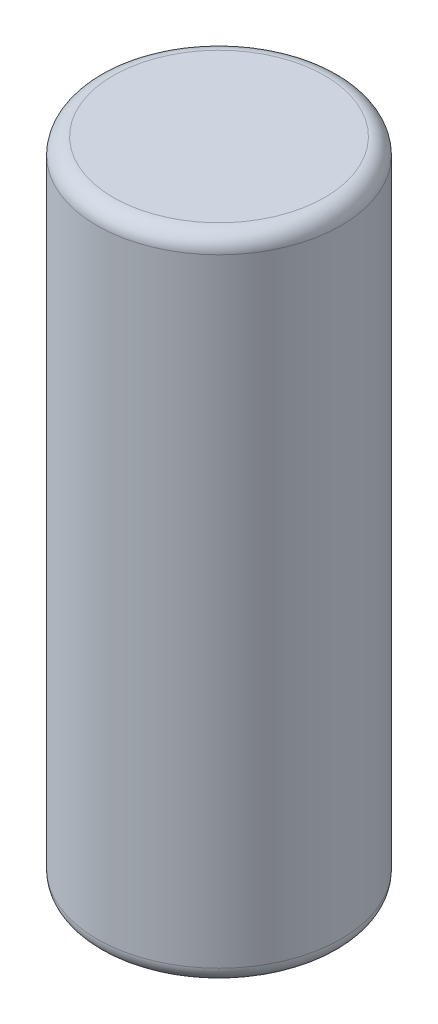
from build123d import *

# Parameters (mm, degrees)
SKETCH1_R           = 75
BOSS_EXTRUDE1_DEPTH = 400
FILLET1_R           = 10
FILLET2_R           = 10


with BuildPart() as part:
    # Sketch1 → Boss-Extrude1 (new body)
    with BuildSketch(Plane(origin=(0, 0, 0), x_dir=(1, 0, 0), z_dir=(0, 1, 0))):
        with Locations(Location((0, 0, 0), (0, 0, 90))):
            Circle(SKETCH1_R)
    extrude(amount=BOSS_EXTRUDE1_DEPTH)

    # Fillet1
    fillet1_edges = [part.edges().sort_by_distance(p)[0] for p in [
        (0, 400, 75),
    ]]
    fillet(fillet1_edges, radius=FILLET1_R)

    # Fillet2
    fillet2_edges = [part.edges().sort_by_distance(p)[0] for p in [
        (0, 0, 75),
    ]]
    fillet(fillet2_edges, radius=FILLET2_R)


solid = part.part
